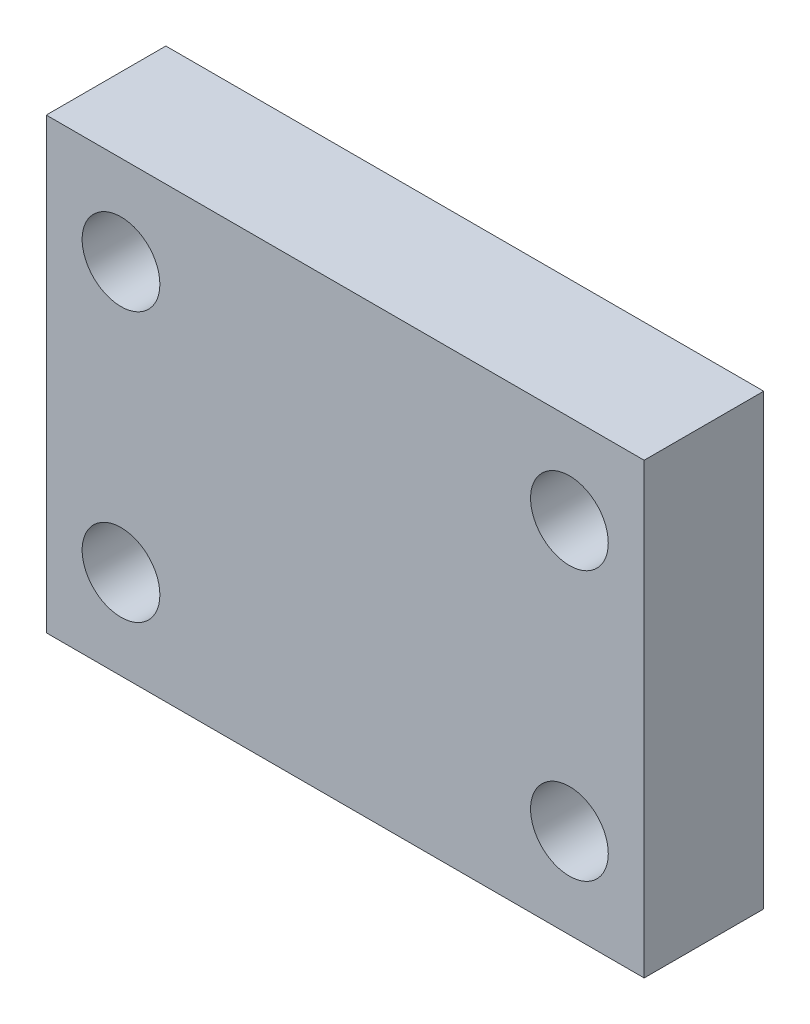
from build123d import *

# Parameters (mm, degrees)
SKETCH_1_W      = 40
SKETCH_1_H      = 30
SKETCH_1_R      = 2.6
EXTRUDE_1_DEPTH = 8


with BuildPart() as part:
    # 草图1 → 凸台-拉伸1 (new body)
    with BuildSketch(Plane.XY):
        Rectangle(SKETCH_1_W, SKETCH_1_H)
        with Locations((-15, -9)):
            Circle(SKETCH_1_R, mode=Mode.SUBTRACT)
        with Locations((15, -9)):
            Circle(SKETCH_1_R, mode=Mode.SUBTRACT)
        with Locations((-15, 9)):
            Circle(SKETCH_1_R, mode=Mode.SUBTRACT)
        with Locations((15, 9)):
            Circle(SKETCH_1_R, mode=Mode.SUBTRACT)
    extrude(amount=EXTRUDE_1_DEPTH)


solid = part.part
